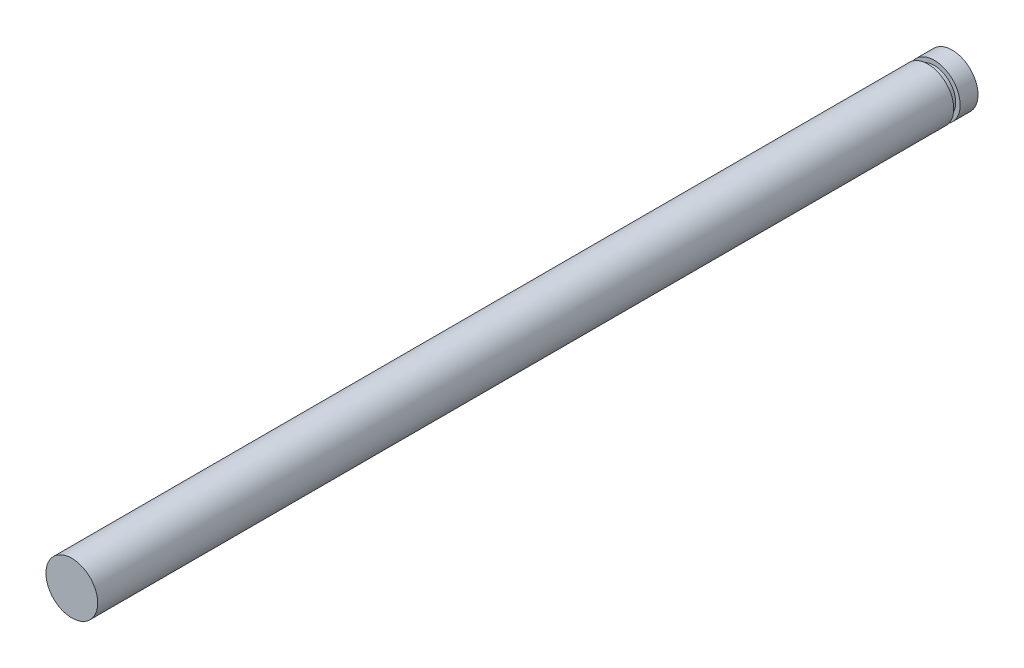
from build123d import *

# Parameters (mm, degrees)
SCALE1_SCALE = 25.4


with BuildPart() as part:
    # Sketch1 → Revolve1 (revolve)
    with BuildSketch(Plane(origin=(0, 0, 0), x_dir=(0, 0, -1), z_dir=(1, 0, 0)), mode=Mode.PRIVATE) as revolve1_sk:
        Polygon((0, 0.725), (24, 0.725), (24, 0.6), (24.18, 0.6), (24.18, 0.725), (24.68, 0.725), (24.68, 0), (0, 0), align=None)
    revolve(revolve1_sk.sketch.rotate(Axis((0, 0, 0), (0, 0, -1)), 90), axis=Axis((0, 0, 0), (0, 0, -1)))


with BuildPart() as part_1:
    # Scale1: scaled about (0, 0, -12.312934608)
    add(part.part.scale(SCALE1_SCALE).moved(Location((0, 0, 300.435604435))))


solid = part_1.part
